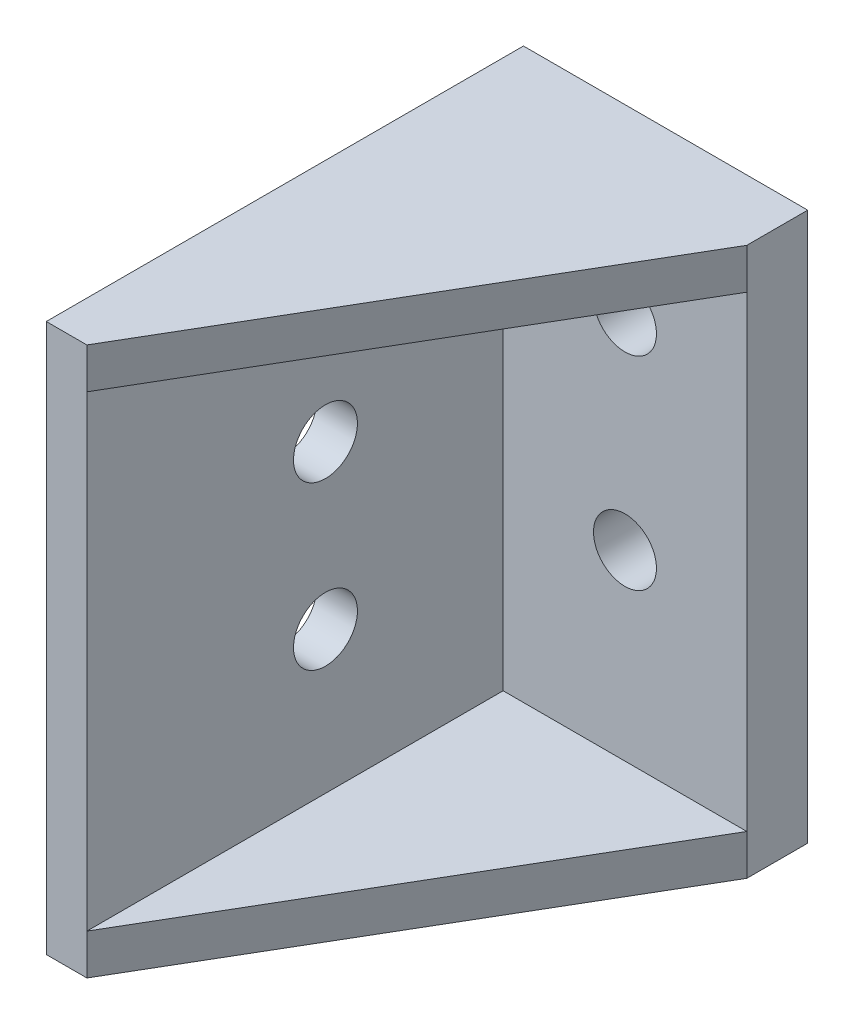
from build123d import *

# Parameters (mm, degrees)
SKETCH1_W           = 14
SKETCH1_H           = 25
SKETCH1_R           = 1.55
BOSS_EXTRUDE1_DEPTH = 3
BOSS_EXTRUDE2_DEPTH = 20.5
SKETCH4_R           = 1.575
CUT_EXTRUDE1_DEPTH  = 38.057387927
CUT_EXTRUDE2_DEPTH  = 20.5
BOSS_EXTRUDE3_DEPTH = 2


with BuildPart() as part:
    # Sketch1 → Boss-Extrude1 (new body)
    with BuildSketch(Plane.XY):
        with Locations((7, 12.5)):
            Rectangle(SKETCH1_W, SKETCH1_H)
        with Locations((8, 19)):
            Circle(SKETCH1_R, mode=Mode.SUBTRACT)
        with Locations((8, 9)):
            Circle(SKETCH1_R, mode=Mode.SUBTRACT)
    extrude(amount=BOSS_EXTRUDE1_DEPTH)

    # Sketch3 → Boss-Extrude2 (add)
    with BuildSketch(Plane.XY.offset(3)):
        Polygon((0, 0), (0, 25), (14, 25), (14, 23), (2, 23), (2, 0), align=None)
    extrude(amount=BOSS_EXTRUDE2_DEPTH)

    # Sketch4 → Cut-Extrude1 (cut, through all)
    with BuildSketch(Plane.ZY):
        with Locations(Location((11.75, 15, 0), (0, 0, 270))):
            Circle(SKETCH4_R)
        with Locations(Location((11.75, 7, 0), (0, 0, 270))):
            Circle(SKETCH4_R)
    extrude(amount=-CUT_EXTRUDE1_DEPTH, mode=Mode.SUBTRACT)

    # Sketch5 → Cut-Extrude2 (cut)
    with BuildSketch(Plane(origin=(0, 23, 0), x_dir=(-1, 0, 0), z_dir=(0, -1, 0))):
        Polygon((-14, -3), (-2, -23.5), (-14, -23.5), align=None)
    extrude(amount=-CUT_EXTRUDE2_DEPTH, mode=Mode.SUBTRACT)

    # Sketch6 → Boss-Extrude3 (add)
    with BuildSketch(Plane(origin=(0, 0, 0), x_dir=(-1, 0, 0), z_dir=(0, -1, 0))):
        Polygon((-14, 0), (-14, -3), (-2, -23.5), (0, -23.5), (0, 0), align=None)
    extrude(amount=BOSS_EXTRUDE3_DEPTH)


solid = part.part
